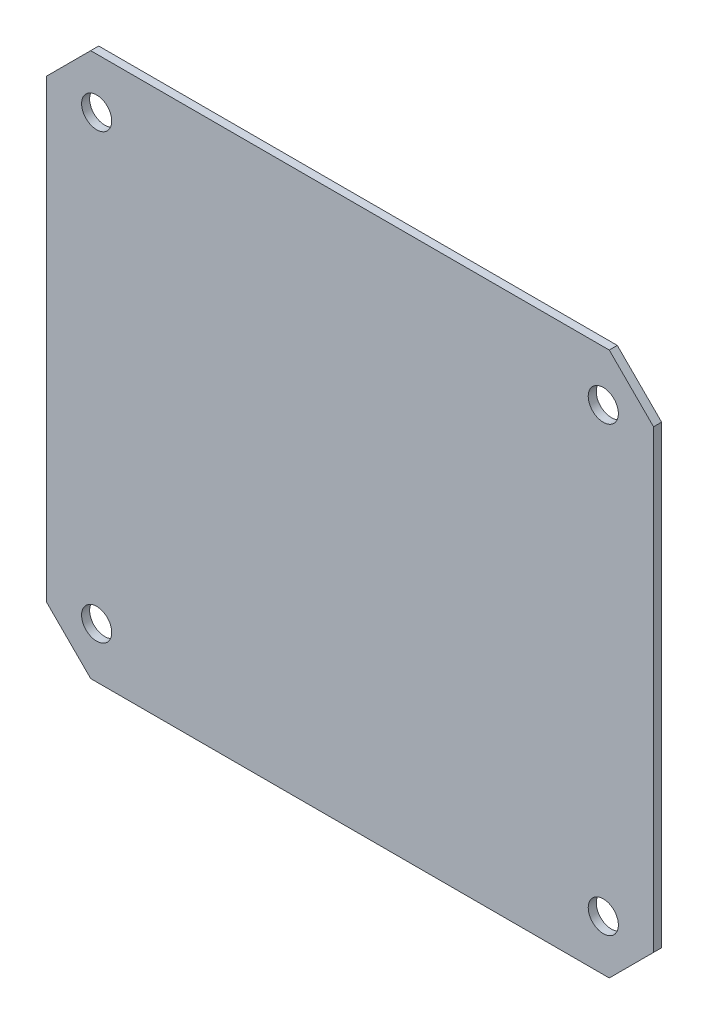
from build123d import *

# Parameters (mm, degrees)
EXTRUDE_1_DEPTH     = 22.2
EXTRUDE_2_DEPTH     = 4.5
SKETCH_3_R          = 1.5
CUT_EXTRUDE_1_DEPTH = 47.223181414
CUT_EXTRUDE_3_DEPTH = 3.7
CUT_EXTRUDE_4_REACH = 67.816
SKETCH_6_W          = 9
SKETCH_6_H          = 7.6
SKETCH_6_W_2        = 11
SKETCH_6_H_2        = 6
CUT_EXTRUDE_5_REACH = 67.816
SKETCH_7_W          = 5
SKETCH_7_H          = 5
SKETCH_8_R          = 1.5
EXTRUDE_3_DEPTH     = 0.8
SKETCH_10_W         = 60.4
SKETCH_10_H         = 26.7
CUT_EXTRUDE_7_DEPTH = 66.815575664


with BuildPart() as part:
    # 草圖1 → 填料-伸長1 (new body)
    with BuildSketch(Plane.XY):
        Polygon((-25.794213562, 27.05), (25.794213562, 27.05), (30.2, 22.644213562), (30.2, -22.644213562), (25.794213562, -27.05), (-25.794213562, -27.05), (-30.2, -22.644213562), (-30.2, 22.644213562), align=None)
        Polygon((-29.4, 22.312842712), (-25.462842712, 26.25), (25.462842712, 26.25), (29.4, 22.312842712), (29.4, -22.312842712), (25.462842712, -26.25), (-25.462842712, -26.25), (-29.4, -22.312842712), align=None, mode=Mode.SUBTRACT)
    extrude(amount=EXTRUDE_1_DEPTH)

    # 草圖2 → 填料-伸長2 (add)
    with BuildSketch(Plane(origin=(0, 0, 0), x_dir=(-1, 0, 0), z_dir=(0, 0, -1))):
        Polygon((-30.2, 22.644213562), (-25.794213562, 27.05), (25.794213562, 27.05), (30.2, 22.644213562), (30.2, -22.644213562), (25.794213562, -27.05), (-25.794213562, -27.05), (-30.2, -22.644213562), align=None)
    extrude(amount=EXTRUDE_2_DEPTH)

    # 草圖3 → 除料-伸長1 (cut, through all)
    with BuildSketch(Plane.XY):
        with Locations((25.2, 22.03)):
            Circle(SKETCH_3_R)
        with Locations(Location((25.2, -22.03, 0), (0, 0, 180))):
            Circle(SKETCH_3_R)
        with Locations((-25.2, -22.03)):
            Circle(SKETCH_3_R)
        with Locations(Location((-25.2, 22.03, 0), (0, 0, 180))):
            Circle(SKETCH_3_R)
    extrude(amount=-CUT_EXTRUDE_1_DEPTH, mode=Mode.SUBTRACT)

    # 草圖5 → 除料-伸長3 (cut)
    with BuildSketch(Plane.XY):
        with BuildLine():
            Line((-25.234050993, 18.530165643), (-25.234050993, -18.530165643))
            ThreePointArc((-25.234050993, -18.530165643), (-22.715358839, -19.564932394), (-21.700544406, -22.091729589))
            Line((-21.700544406, -22.091729589), (21.700544406, -22.091729589))
            ThreePointArc((21.700544406, -22.091729589), (22.737758998, -19.542557689), (25.297360416, -18.531354412))
            Line((25.297360416, -18.531354412), (25.297360416, 18.531354412))
            ThreePointArc((25.297360416, 18.531354412), (22.56426249, 19.727200014), (21.74608079, 22.596076045))
            Line((21.74608079, 22.596076045), (-21.74608079, 22.596076045))
            ThreePointArc((-21.74608079, 22.596076045), (-22.543539666, 19.751136578), (-25.234050993, 18.530165643))
        make_face()
    extrude(amount=-CUT_EXTRUDE_3_DEPTH, mode=Mode.SUBTRACT)

    # 草圖6 → 除料-伸長4 (cut, up to next)
    with BuildSketch(Plane.XZ.offset(27.05), mode=Mode.PRIVATE) as cut_extrude_4_sk1:
        with Locations((6.7, 4.9)):
            Rectangle(SKETCH_6_W, SKETCH_6_H)
    cut_extrude_4_tool1 = extrude(cut_extrude_4_sk1.sketch, amount=-CUT_EXTRUDE_4_REACH, mode=Mode.PRIVATE) & part.part
    # 草圖6 → 除料-伸長4 (cut, up to next)
    with BuildSketch(Plane.XZ.offset(27.05), mode=Mode.PRIVATE) as cut_extrude_4_sk2:
        with Locations((-11.7, 14.2)):
            Rectangle(SKETCH_6_W_2, SKETCH_6_H_2)
    cut_extrude_4_tool2 = extrude(cut_extrude_4_sk2.sketch, amount=-CUT_EXTRUDE_4_REACH, mode=Mode.PRIVATE) & part.part
    add(cut_extrude_4_tool1.solids().sort_by_distance((6.7, -27.05, 4.9))[0], mode=Mode.SUBTRACT)
    add(cut_extrude_4_tool2.solids().sort_by_distance((-11.7, -27.05, 14.2))[0], mode=Mode.SUBTRACT)

    # 草圖7 → 除料-伸長5 (cut, up to next)
    with BuildSketch(Plane(origin=(0, 27.05, 0), x_dir=(1, 0, 0), z_dir=(0, 1, 0)), mode=Mode.PRIVATE) as cut_extrude_5_sk1:
        with Locations((0, -8.85)):
            Rectangle(SKETCH_7_W, SKETCH_7_H)
    cut_extrude_5_tool1 = extrude(cut_extrude_5_sk1.sketch, amount=-CUT_EXTRUDE_5_REACH, mode=Mode.PRIVATE) & part.part
    add(cut_extrude_5_tool1.solids().sort_by_distance((0, 27.05, 8.85))[0], mode=Mode.SUBTRACT)

    # 草圖8 → 填料-伸長3 (add)
    with BuildSketch(Plane(origin=(0, 0, -4.5), x_dir=(-1, 0, 0), z_dir=(0, 0, -1))):
        Polygon((30.2, -22.644213562), (25.794213562, -27.05), (-25.794213562, -27.05), (-30.2, -22.644213562), (-30.2, 22.644213562), (-25.794213562, 27.05), (25.794213562, 27.05), (30.2, 22.644213562), align=None)
        with Locations(Location((25.2, -22.03, 0), (0, 0, 180))):
            Circle(SKETCH_8_R, mode=Mode.SUBTRACT)
        with Locations((-25.2, -22.03)):
            Circle(SKETCH_8_R, mode=Mode.SUBTRACT)
        with Locations(Location((-25.2, 22.03, 0), (0, 0, 180))):
            Circle(SKETCH_8_R, mode=Mode.SUBTRACT)
        with Locations((25.2, 22.03)):
            Circle(SKETCH_8_R, mode=Mode.SUBTRACT)
    extrude(amount=EXTRUDE_3_DEPTH)

    # 草圖10 → 除料-伸長7 (cut, through all)
    with BuildSketch(Plane(origin=(0, 27.05, 0), x_dir=(1, 0, 0), z_dir=(0, 1, 0))):
        with Locations((0, -8.85)):
            Rectangle(SKETCH_10_W, SKETCH_10_H)
    extrude(amount=-CUT_EXTRUDE_7_DEPTH, mode=Mode.SUBTRACT)


solid = part.part
